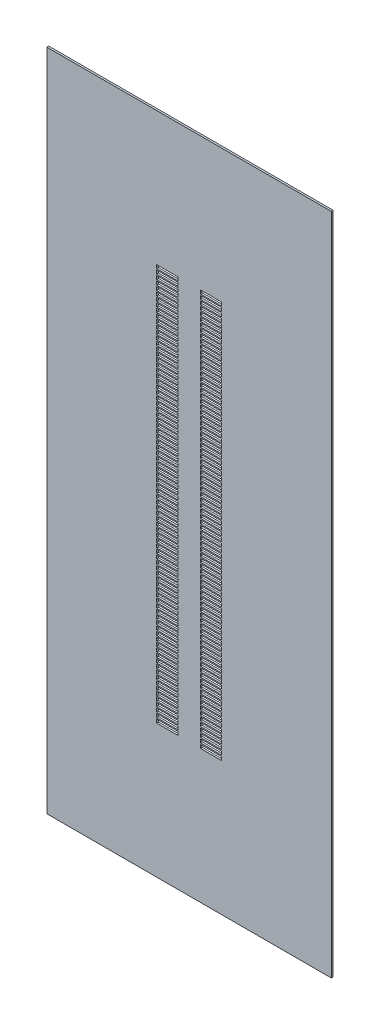
from build123d import *

# Parameters (mm, degrees)
SKETCH1_W          = 30
SKETCH1_H          = 70
SKETCH1_W_2        = 2.22
SKETCH1_H_2        = 0.37
BOSS_EXTRU_1_DEPTH = 0.2


with BuildPart() as part:
    # Sketch1 → Boss.-Extru.1 (new body)
    with BuildSketch(Plane.XY):
        with Locations((0, -20.935)):
            Rectangle(SKETCH1_W, SKETCH1_H)
        with Locations((-2.3, -0.185)):
            Rectangle(SKETCH1_W_2, SKETCH1_H_2, mode=Mode.SUBTRACT)
        with Locations((2.3, -0.185)):
            Rectangle(SKETCH1_W_2, SKETCH1_H_2, mode=Mode.SUBTRACT)
        with Locations((2.3, -0.685)):
            Rectangle(SKETCH1_W_2, SKETCH1_H_2, mode=Mode.SUBTRACT)
        with Locations((-2.3, -0.685)):
            Rectangle(SKETCH1_W_2, SKETCH1_H_2, mode=Mode.SUBTRACT)
        with Locations((2.3, -1.185)):
            Rectangle(SKETCH1_W_2, SKETCH1_H_2, mode=Mode.SUBTRACT)
        with Locations((-2.3, -1.185)):
            Rectangle(SKETCH1_W_2, SKETCH1_H_2, mode=Mode.SUBTRACT)
        with Locations((2.3, -1.685)):
            Rectangle(SKETCH1_W_2, SKETCH1_H_2, mode=Mode.SUBTRACT)
        with Locations((-2.3, -1.685)):
            Rectangle(SKETCH1_W_2, SKETCH1_H_2, mode=Mode.SUBTRACT)
        with Locations((2.3, -2.185)):
            Rectangle(SKETCH1_W_2, SKETCH1_H_2, mode=Mode.SUBTRACT)
        with Locations((-2.3, -2.185)):
            Rectangle(SKETCH1_W_2, SKETCH1_H_2, mode=Mode.SUBTRACT)
        with Locations((2.3, -2.685)):
            Rectangle(SKETCH1_W_2, SKETCH1_H_2, mode=Mode.SUBTRACT)
        with Locations((-2.3, -2.685)):
            Rectangle(SKETCH1_W_2, SKETCH1_H_2, mode=Mode.SUBTRACT)
        with Locations((2.3, -3.185)):
            Rectangle(SKETCH1_W_2, SKETCH1_H_2, mode=Mode.SUBTRACT)
        with Locations((-2.3, -3.185)):
            Rectangle(SKETCH1_W_2, SKETCH1_H_2, mode=Mode.SUBTRACT)
        with Locations((2.3, -3.685)):
            Rectangle(SKETCH1_W_2, SKETCH1_H_2, mode=Mode.SUBTRACT)
        with Locations((-2.3, -3.685)):
            Rectangle(SKETCH1_W_2, SKETCH1_H_2, mode=Mode.SUBTRACT)
        with Locations((2.3, -4.185)):
            Rectangle(SKETCH1_W_2, SKETCH1_H_2, mode=Mode.SUBTRACT)
        with Locations((-2.3, -4.185)):
            Rectangle(SKETCH1_W_2, SKETCH1_H_2, mode=Mode.SUBTRACT)
        with Locations((2.3, -4.685)):
            Rectangle(SKETCH1_W_2, SKETCH1_H_2, mode=Mode.SUBTRACT)
        with Locations((-2.3, -4.685)):
            Rectangle(SKETCH1_W_2, SKETCH1_H_2, mode=Mode.SUBTRACT)
        with Locations((2.3, -5.185)):
            Rectangle(SKETCH1_W_2, SKETCH1_H_2, mode=Mode.SUBTRACT)
        with Locations((-2.3, -5.185)):
            Rectangle(SKETCH1_W_2, SKETCH1_H_2, mode=Mode.SUBTRACT)
        with Locations((2.3, -5.685)):
            Rectangle(SKETCH1_W_2, SKETCH1_H_2, mode=Mode.SUBTRACT)
        with Locations((-2.3, -5.685)):
            Rectangle(SKETCH1_W_2, SKETCH1_H_2, mode=Mode.SUBTRACT)
        with Locations((2.3, -6.185)):
            Rectangle(SKETCH1_W_2, SKETCH1_H_2, mode=Mode.SUBTRACT)
        with Locations((-2.3, -6.185)):
            Rectangle(SKETCH1_W_2, SKETCH1_H_2, mode=Mode.SUBTRACT)
        with Locations((2.3, -6.685)):
            Rectangle(SKETCH1_W_2, SKETCH1_H_2, mode=Mode.SUBTRACT)
        with Locations((-2.3, -6.685)):
            Rectangle(SKETCH1_W_2, SKETCH1_H_2, mode=Mode.SUBTRACT)
        with Locations((2.3, -7.185)):
            Rectangle(SKETCH1_W_2, SKETCH1_H_2, mode=Mode.SUBTRACT)
        with Locations((-2.3, -7.185)):
            Rectangle(SKETCH1_W_2, SKETCH1_H_2, mode=Mode.SUBTRACT)
        with Locations((2.3, -7.685)):
            Rectangle(SKETCH1_W_2, SKETCH1_H_2, mode=Mode.SUBTRACT)
        with Locations((-2.3, -7.685)):
            Rectangle(SKETCH1_W_2, SKETCH1_H_2, mode=Mode.SUBTRACT)
        with Locations((2.3, -8.185)):
            Rectangle(SKETCH1_W_2, SKETCH1_H_2, mode=Mode.SUBTRACT)
        with Locations((-2.3, -8.185)):
            Rectangle(SKETCH1_W_2, SKETCH1_H_2, mode=Mode.SUBTRACT)
        with Locations((2.3, -8.685)):
            Rectangle(SKETCH1_W_2, SKETCH1_H_2, mode=Mode.SUBTRACT)
        with Locations((-2.3, -8.685)):
            Rectangle(SKETCH1_W_2, SKETCH1_H_2, mode=Mode.SUBTRACT)
        with Locations((2.3, -9.185)):
            Rectangle(SKETCH1_W_2, SKETCH1_H_2, mode=Mode.SUBTRACT)
        with Locations((-2.3, -9.185)):
            Rectangle(SKETCH1_W_2, SKETCH1_H_2, mode=Mode.SUBTRACT)
        with Locations((2.3, -9.685)):
            Rectangle(SKETCH1_W_2, SKETCH1_H_2, mode=Mode.SUBTRACT)
        with Locations((-2.3, -9.685)):
            Rectangle(SKETCH1_W_2, SKETCH1_H_2, mode=Mode.SUBTRACT)
        with Locations((2.3, -10.185)):
            Rectangle(SKETCH1_W_2, SKETCH1_H_2, mode=Mode.SUBTRACT)
        with Locations((-2.3, -10.185)):
            Rectangle(SKETCH1_W_2, SKETCH1_H_2, mode=Mode.SUBTRACT)
        with Locations((2.3, -10.685)):
            Rectangle(SKETCH1_W_2, SKETCH1_H_2, mode=Mode.SUBTRACT)
        with Locations((-2.3, -10.685)):
            Rectangle(SKETCH1_W_2, SKETCH1_H_2, mode=Mode.SUBTRACT)
        with Locations((2.3, -11.185)):
            Rectangle(SKETCH1_W_2, SKETCH1_H_2, mode=Mode.SUBTRACT)
        with Locations((-2.3, -11.185)):
            Rectangle(SKETCH1_W_2, SKETCH1_H_2, mode=Mode.SUBTRACT)
        with Locations((2.3, -11.685)):
            Rectangle(SKETCH1_W_2, SKETCH1_H_2, mode=Mode.SUBTRACT)
        with Locations((-2.3, -11.685)):
            Rectangle(SKETCH1_W_2, SKETCH1_H_2, mode=Mode.SUBTRACT)
        with Locations((2.3, -12.185)):
            Rectangle(SKETCH1_W_2, SKETCH1_H_2, mode=Mode.SUBTRACT)
        with Locations((-2.3, -12.185)):
            Rectangle(SKETCH1_W_2, SKETCH1_H_2, mode=Mode.SUBTRACT)
        with Locations((2.3, -12.685)):
            Rectangle(SKETCH1_W_2, SKETCH1_H_2, mode=Mode.SUBTRACT)
        with Locations((-2.3, -12.685)):
            Rectangle(SKETCH1_W_2, SKETCH1_H_2, mode=Mode.SUBTRACT)
        with Locations((2.3, -13.185)):
            Rectangle(SKETCH1_W_2, SKETCH1_H_2, mode=Mode.SUBTRACT)
        with Locations((-2.3, -13.185)):
            Rectangle(SKETCH1_W_2, SKETCH1_H_2, mode=Mode.SUBTRACT)
        with Locations((2.3, -13.685)):
            Rectangle(SKETCH1_W_2, SKETCH1_H_2, mode=Mode.SUBTRACT)
        with Locations((-2.3, -13.685)):
            Rectangle(SKETCH1_W_2, SKETCH1_H_2, mode=Mode.SUBTRACT)
        with Locations((2.3, -14.185)):
            Rectangle(SKETCH1_W_2, SKETCH1_H_2, mode=Mode.SUBTRACT)
        with Locations((-2.3, -14.185)):
            Rectangle(SKETCH1_W_2, SKETCH1_H_2, mode=Mode.SUBTRACT)
        with Locations((2.3, -14.685)):
            Rectangle(SKETCH1_W_2, SKETCH1_H_2, mode=Mode.SUBTRACT)
        with Locations((-2.3, -14.685)):
            Rectangle(SKETCH1_W_2, SKETCH1_H_2, mode=Mode.SUBTRACT)
        with Locations((2.3, -15.185)):
            Rectangle(SKETCH1_W_2, SKETCH1_H_2, mode=Mode.SUBTRACT)
        with Locations((-2.3, -15.185)):
            Rectangle(SKETCH1_W_2, SKETCH1_H_2, mode=Mode.SUBTRACT)
        with Locations((2.3, -15.685)):
            Rectangle(SKETCH1_W_2, SKETCH1_H_2, mode=Mode.SUBTRACT)
        with Locations((-2.3, -15.685)):
            Rectangle(SKETCH1_W_2, SKETCH1_H_2, mode=Mode.SUBTRACT)
        with Locations((2.3, -16.185)):
            Rectangle(SKETCH1_W_2, SKETCH1_H_2, mode=Mode.SUBTRACT)
        with Locations((-2.3, -16.185)):
            Rectangle(SKETCH1_W_2, SKETCH1_H_2, mode=Mode.SUBTRACT)
        with Locations((2.3, -16.685)):
            Rectangle(SKETCH1_W_2, SKETCH1_H_2, mode=Mode.SUBTRACT)
        with Locations((-2.3, -16.685)):
            Rectangle(SKETCH1_W_2, SKETCH1_H_2, mode=Mode.SUBTRACT)
        with Locations((2.3, -17.185)):
            Rectangle(SKETCH1_W_2, SKETCH1_H_2, mode=Mode.SUBTRACT)
        with Locations((-2.3, -17.185)):
            Rectangle(SKETCH1_W_2, SKETCH1_H_2, mode=Mode.SUBTRACT)
        with Locations((2.3, -17.685)):
            Rectangle(SKETCH1_W_2, SKETCH1_H_2, mode=Mode.SUBTRACT)
        with Locations((-2.3, -17.685)):
            Rectangle(SKETCH1_W_2, SKETCH1_H_2, mode=Mode.SUBTRACT)
        with Locations((2.3, -18.185)):
            Rectangle(SKETCH1_W_2, SKETCH1_H_2, mode=Mode.SUBTRACT)
        with Locations((-2.3, -18.185)):
            Rectangle(SKETCH1_W_2, SKETCH1_H_2, mode=Mode.SUBTRACT)
        with Locations((2.3, -18.685)):
            Rectangle(SKETCH1_W_2, SKETCH1_H_2, mode=Mode.SUBTRACT)
        with Locations((-2.3, -18.685)):
            Rectangle(SKETCH1_W_2, SKETCH1_H_2, mode=Mode.SUBTRACT)
        with Locations((2.3, -19.185)):
            Rectangle(SKETCH1_W_2, SKETCH1_H_2, mode=Mode.SUBTRACT)
        with Locations((-2.3, -19.185)):
            Rectangle(SKETCH1_W_2, SKETCH1_H_2, mode=Mode.SUBTRACT)
        with Locations((2.3, -19.685)):
            Rectangle(SKETCH1_W_2, SKETCH1_H_2, mode=Mode.SUBTRACT)
        with Locations((-2.3, -19.685)):
            Rectangle(SKETCH1_W_2, SKETCH1_H_2, mode=Mode.SUBTRACT)
        with Locations((2.3, -20.185)):
            Rectangle(SKETCH1_W_2, SKETCH1_H_2, mode=Mode.SUBTRACT)
        with Locations((-2.3, -20.185)):
            Rectangle(SKETCH1_W_2, SKETCH1_H_2, mode=Mode.SUBTRACT)
        with Locations((2.3, -20.685)):
            Rectangle(SKETCH1_W_2, SKETCH1_H_2, mode=Mode.SUBTRACT)
        with Locations((-2.3, -20.685)):
            Rectangle(SKETCH1_W_2, SKETCH1_H_2, mode=Mode.SUBTRACT)
        with Locations((2.3, -21.185)):
            Rectangle(SKETCH1_W_2, SKETCH1_H_2, mode=Mode.SUBTRACT)
        with Locations((-2.3, -21.185)):
            Rectangle(SKETCH1_W_2, SKETCH1_H_2, mode=Mode.SUBTRACT)
        with Locations((2.3, -21.685)):
            Rectangle(SKETCH1_W_2, SKETCH1_H_2, mode=Mode.SUBTRACT)
        with Locations((-2.3, -21.685)):
            Rectangle(SKETCH1_W_2, SKETCH1_H_2, mode=Mode.SUBTRACT)
        with Locations((2.3, -22.185)):
            Rectangle(SKETCH1_W_2, SKETCH1_H_2, mode=Mode.SUBTRACT)
        with Locations((-2.3, -22.185)):
            Rectangle(SKETCH1_W_2, SKETCH1_H_2, mode=Mode.SUBTRACT)
        with Locations((2.3, -22.685)):
            Rectangle(SKETCH1_W_2, SKETCH1_H_2, mode=Mode.SUBTRACT)
        with Locations((-2.3, -22.685)):
            Rectangle(SKETCH1_W_2, SKETCH1_H_2, mode=Mode.SUBTRACT)
        with Locations((2.3, -23.185)):
            Rectangle(SKETCH1_W_2, SKETCH1_H_2, mode=Mode.SUBTRACT)
        with Locations((-2.3, -23.185)):
            Rectangle(SKETCH1_W_2, SKETCH1_H_2, mode=Mode.SUBTRACT)
        with Locations((2.3, -23.685)):
            Rectangle(SKETCH1_W_2, SKETCH1_H_2, mode=Mode.SUBTRACT)
        with Locations((-2.3, -23.685)):
            Rectangle(SKETCH1_W_2, SKETCH1_H_2, mode=Mode.SUBTRACT)
        with Locations((2.3, -24.185)):
            Rectangle(SKETCH1_W_2, SKETCH1_H_2, mode=Mode.SUBTRACT)
        with Locations((-2.3, -24.185)):
            Rectangle(SKETCH1_W_2, SKETCH1_H_2, mode=Mode.SUBTRACT)
        with Locations((2.3, -24.685)):
            Rectangle(SKETCH1_W_2, SKETCH1_H_2, mode=Mode.SUBTRACT)
        with Locations((-2.3, -24.685)):
            Rectangle(SKETCH1_W_2, SKETCH1_H_2, mode=Mode.SUBTRACT)
        with Locations((2.3, -25.185)):
            Rectangle(SKETCH1_W_2, SKETCH1_H_2, mode=Mode.SUBTRACT)
        with Locations((-2.3, -25.185)):
            Rectangle(SKETCH1_W_2, SKETCH1_H_2, mode=Mode.SUBTRACT)
        with Locations((2.3, -25.685)):
            Rectangle(SKETCH1_W_2, SKETCH1_H_2, mode=Mode.SUBTRACT)
        with Locations((-2.3, -25.685)):
            Rectangle(SKETCH1_W_2, SKETCH1_H_2, mode=Mode.SUBTRACT)
        with Locations((2.3, -26.185)):
            Rectangle(SKETCH1_W_2, SKETCH1_H_2, mode=Mode.SUBTRACT)
        with Locations((-2.3, -26.185)):
            Rectangle(SKETCH1_W_2, SKETCH1_H_2, mode=Mode.SUBTRACT)
        with Locations((2.3, -26.685)):
            Rectangle(SKETCH1_W_2, SKETCH1_H_2, mode=Mode.SUBTRACT)
        with Locations((-2.3, -26.685)):
            Rectangle(SKETCH1_W_2, SKETCH1_H_2, mode=Mode.SUBTRACT)
        with Locations((2.3, -27.185)):
            Rectangle(SKETCH1_W_2, SKETCH1_H_2, mode=Mode.SUBTRACT)
        with Locations((-2.3, -27.185)):
            Rectangle(SKETCH1_W_2, SKETCH1_H_2, mode=Mode.SUBTRACT)
        with Locations((2.3, -27.685)):
            Rectangle(SKETCH1_W_2, SKETCH1_H_2, mode=Mode.SUBTRACT)
        with Locations((-2.3, -27.685)):
            Rectangle(SKETCH1_W_2, SKETCH1_H_2, mode=Mode.SUBTRACT)
        with Locations((2.3, -28.185)):
            Rectangle(SKETCH1_W_2, SKETCH1_H_2, mode=Mode.SUBTRACT)
        with Locations((-2.3, -28.185)):
            Rectangle(SKETCH1_W_2, SKETCH1_H_2, mode=Mode.SUBTRACT)
        with Locations((2.3, -28.685)):
            Rectangle(SKETCH1_W_2, SKETCH1_H_2, mode=Mode.SUBTRACT)
        with Locations((-2.3, -28.685)):
            Rectangle(SKETCH1_W_2, SKETCH1_H_2, mode=Mode.SUBTRACT)
        with Locations((2.3, -29.185)):
            Rectangle(SKETCH1_W_2, SKETCH1_H_2, mode=Mode.SUBTRACT)
        with Locations((-2.3, -29.185)):
            Rectangle(SKETCH1_W_2, SKETCH1_H_2, mode=Mode.SUBTRACT)
        with Locations((2.3, -29.685)):
            Rectangle(SKETCH1_W_2, SKETCH1_H_2, mode=Mode.SUBTRACT)
        with Locations((-2.3, -29.685)):
            Rectangle(SKETCH1_W_2, SKETCH1_H_2, mode=Mode.SUBTRACT)
        with Locations((2.3, -30.185)):
            Rectangle(SKETCH1_W_2, SKETCH1_H_2, mode=Mode.SUBTRACT)
        with Locations((-2.3, -30.185)):
            Rectangle(SKETCH1_W_2, SKETCH1_H_2, mode=Mode.SUBTRACT)
        with Locations((2.3, -30.685)):
            Rectangle(SKETCH1_W_2, SKETCH1_H_2, mode=Mode.SUBTRACT)
        with Locations((-2.3, -30.685)):
            Rectangle(SKETCH1_W_2, SKETCH1_H_2, mode=Mode.SUBTRACT)
        with Locations((2.3, -31.185)):
            Rectangle(SKETCH1_W_2, SKETCH1_H_2, mode=Mode.SUBTRACT)
        with Locations((-2.3, -31.185)):
            Rectangle(SKETCH1_W_2, SKETCH1_H_2, mode=Mode.SUBTRACT)
        with Locations((2.3, -31.685)):
            Rectangle(SKETCH1_W_2, SKETCH1_H_2, mode=Mode.SUBTRACT)
        with Locations((-2.3, -31.685)):
            Rectangle(SKETCH1_W_2, SKETCH1_H_2, mode=Mode.SUBTRACT)
        with Locations((2.3, -32.185)):
            Rectangle(SKETCH1_W_2, SKETCH1_H_2, mode=Mode.SUBTRACT)
        with Locations((-2.3, -32.185)):
            Rectangle(SKETCH1_W_2, SKETCH1_H_2, mode=Mode.SUBTRACT)
        with Locations((2.3, -32.685)):
            Rectangle(SKETCH1_W_2, SKETCH1_H_2, mode=Mode.SUBTRACT)
        with Locations((-2.3, -32.685)):
            Rectangle(SKETCH1_W_2, SKETCH1_H_2, mode=Mode.SUBTRACT)
        with Locations((2.3, -33.185)):
            Rectangle(SKETCH1_W_2, SKETCH1_H_2, mode=Mode.SUBTRACT)
        with Locations((-2.3, -33.185)):
            Rectangle(SKETCH1_W_2, SKETCH1_H_2, mode=Mode.SUBTRACT)
        with Locations((2.3, -33.685)):
            Rectangle(SKETCH1_W_2, SKETCH1_H_2, mode=Mode.SUBTRACT)
        with Locations((-2.3, -33.685)):
            Rectangle(SKETCH1_W_2, SKETCH1_H_2, mode=Mode.SUBTRACT)
        with Locations((2.3, -34.185)):
            Rectangle(SKETCH1_W_2, SKETCH1_H_2, mode=Mode.SUBTRACT)
        with Locations((-2.3, -34.185)):
            Rectangle(SKETCH1_W_2, SKETCH1_H_2, mode=Mode.SUBTRACT)
        with Locations((2.3, -34.685)):
            Rectangle(SKETCH1_W_2, SKETCH1_H_2, mode=Mode.SUBTRACT)
        with Locations((-2.3, -34.685)):
            Rectangle(SKETCH1_W_2, SKETCH1_H_2, mode=Mode.SUBTRACT)
        with Locations((2.3, -35.185)):
            Rectangle(SKETCH1_W_2, SKETCH1_H_2, mode=Mode.SUBTRACT)
        with Locations((-2.3, -35.185)):
            Rectangle(SKETCH1_W_2, SKETCH1_H_2, mode=Mode.SUBTRACT)
        with Locations((2.3, -35.685)):
            Rectangle(SKETCH1_W_2, SKETCH1_H_2, mode=Mode.SUBTRACT)
        with Locations((-2.3, -35.685)):
            Rectangle(SKETCH1_W_2, SKETCH1_H_2, mode=Mode.SUBTRACT)
        with Locations((2.3, -36.185)):
            Rectangle(SKETCH1_W_2, SKETCH1_H_2, mode=Mode.SUBTRACT)
        with Locations((-2.3, -36.185)):
            Rectangle(SKETCH1_W_2, SKETCH1_H_2, mode=Mode.SUBTRACT)
        with Locations((2.3, -36.685)):
            Rectangle(SKETCH1_W_2, SKETCH1_H_2, mode=Mode.SUBTRACT)
        with Locations((-2.3, -36.685)):
            Rectangle(SKETCH1_W_2, SKETCH1_H_2, mode=Mode.SUBTRACT)
        with Locations((2.3, -37.185)):
            Rectangle(SKETCH1_W_2, SKETCH1_H_2, mode=Mode.SUBTRACT)
        with Locations((-2.3, -37.185)):
            Rectangle(SKETCH1_W_2, SKETCH1_H_2, mode=Mode.SUBTRACT)
        with Locations((2.3, -37.685)):
            Rectangle(SKETCH1_W_2, SKETCH1_H_2, mode=Mode.SUBTRACT)
        with Locations((-2.3, -37.685)):
            Rectangle(SKETCH1_W_2, SKETCH1_H_2, mode=Mode.SUBTRACT)
        with Locations((2.3, -38.185)):
            Rectangle(SKETCH1_W_2, SKETCH1_H_2, mode=Mode.SUBTRACT)
        with Locations((-2.3, -38.185)):
            Rectangle(SKETCH1_W_2, SKETCH1_H_2, mode=Mode.SUBTRACT)
        with Locations((2.3, -38.685)):
            Rectangle(SKETCH1_W_2, SKETCH1_H_2, mode=Mode.SUBTRACT)
        with Locations((-2.3, -38.685)):
            Rectangle(SKETCH1_W_2, SKETCH1_H_2, mode=Mode.SUBTRACT)
        with Locations((2.3, -39.185)):
            Rectangle(SKETCH1_W_2, SKETCH1_H_2, mode=Mode.SUBTRACT)
        with Locations((-2.3, -39.185)):
            Rectangle(SKETCH1_W_2, SKETCH1_H_2, mode=Mode.SUBTRACT)
        with Locations((2.3, -39.685)):
            Rectangle(SKETCH1_W_2, SKETCH1_H_2, mode=Mode.SUBTRACT)
        with Locations((-2.3, -39.685)):
            Rectangle(SKETCH1_W_2, SKETCH1_H_2, mode=Mode.SUBTRACT)
        with Locations((2.3, -40.185)):
            Rectangle(SKETCH1_W_2, SKETCH1_H_2, mode=Mode.SUBTRACT)
        with Locations((-2.3, -40.185)):
            Rectangle(SKETCH1_W_2, SKETCH1_H_2, mode=Mode.SUBTRACT)
        with Locations((2.3, -40.685)):
            Rectangle(SKETCH1_W_2, SKETCH1_H_2, mode=Mode.SUBTRACT)
        with Locations((-2.3, -40.685)):
            Rectangle(SKETCH1_W_2, SKETCH1_H_2, mode=Mode.SUBTRACT)
        with Locations((2.3, -41.185)):
            Rectangle(SKETCH1_W_2, SKETCH1_H_2, mode=Mode.SUBTRACT)
        with Locations((-2.3, -41.185)):
            Rectangle(SKETCH1_W_2, SKETCH1_H_2, mode=Mode.SUBTRACT)
        with Locations((2.3, -41.685)):
            Rectangle(SKETCH1_W_2, SKETCH1_H_2, mode=Mode.SUBTRACT)
        with Locations((-2.3, -41.685)):
            Rectangle(SKETCH1_W_2, SKETCH1_H_2, mode=Mode.SUBTRACT)
    extrude(amount=BOSS_EXTRU_1_DEPTH)


solid = part.part
